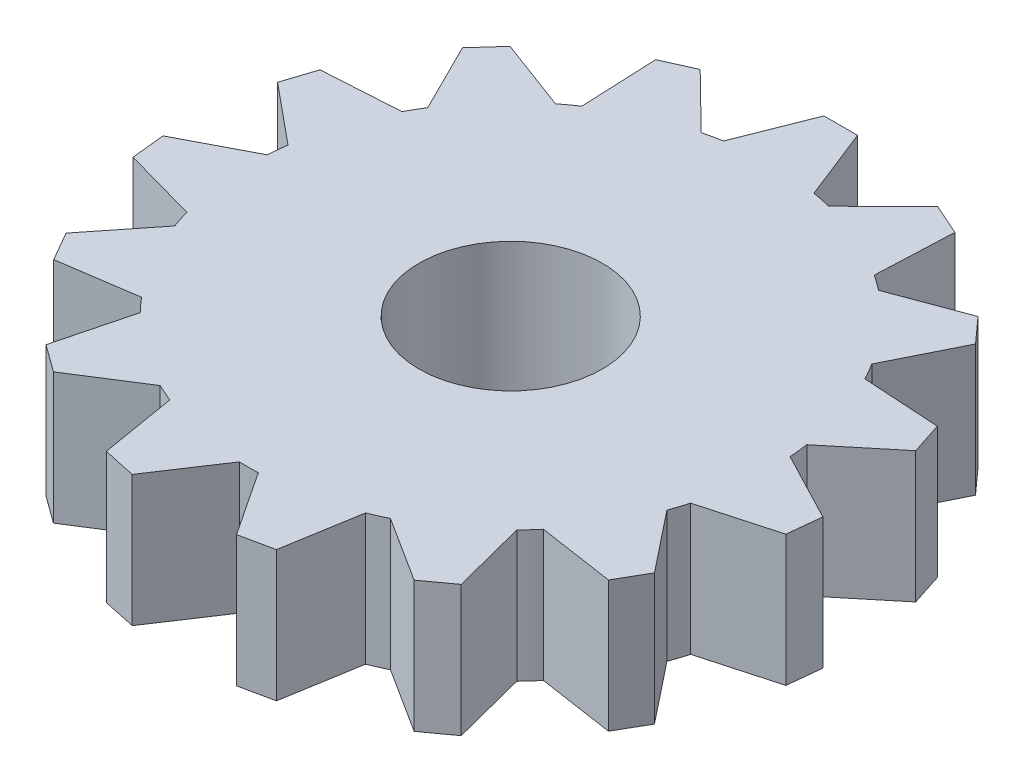
from build123d import *

# Parameters (mm, degrees)
CROQUIS1_R              = 5.25
SALIENTE_EXTRUIR1_DEPTH = 7.5


with BuildPart() as part:
    # Croquis1 → Saliente-Extruir1 (new body)
    with BuildSketch(Plane(origin=(0, 0, 0), x_dir=(1, 0, 0), z_dir=(0, 1, 0))):
        with BuildLine():
            Line((-2.5, 15), (-0.96403744, 18.894029408))
            Line((-0.96403744, 18.894029408), (0.96403744, 18.894029408))
            Line((0.96403744, 18.894029408), (2.5, 15))
            Line((2.5, 15), (2.588781311, 14.774918319))
            ThreePointArc((2.588781311, 14.774918319), (3.118675362, 14.672214011), (3.644531271, 14.550511737))
            Line((3.644531271, 14.550511737), (3.817186002, 14.720023472))
            Line((3.817186002, 14.720023472), (6.804202071, 17.652664095))
            Line((6.804202071, 17.652664095), (8.56558612, 16.86844539))
            Line((8.56558612, 16.86844539), (8.38491329, 12.686340257))
            Line((8.38491329, 12.686340257), (8.374470086, 12.444607297))
            ThreePointArc((8.374470086, 12.444607297), (8.816778784, 12.135254916), (9.247671287, 11.810189489))
            Line((9.247671287, 11.810189489), (9.474345866, 11.894821159))
            Line((9.474345866, 11.894821159), (13.39593323, 13.35899279))
            Line((13.39593323, 13.35899279), (14.686067144, 11.926153919))
            Line((14.686067144, 11.926153919), (12.819998898, 8.179097032))
            Line((12.819998898, 8.179097032), (12.712136904, 7.962510618))
            ThreePointArc((12.712136904, 7.962510618), (12.990381057, 7.5), (13.251804925, 7.027778186))
            Line((13.251804925, 7.027778186), (13.493305258, 7.012896206))
            Line((13.493305258, 7.012896206), (17.671385836, 6.755430269))
            Line((17.671385836, 6.755430269), (18.26719374, 4.92172209))
            Line((18.26719374, 4.92172209), (15.03839023, 2.257613625))
            Line((15.03839023, 2.257613625), (14.851759765, 2.103623516))
            ThreePointArc((14.851759765, 2.103623516), (14.917828431, 1.567926949), (14.964581102, 1.030200189))
            Line((14.964581102, 1.030200189), (15.179149589, 0.918377789))
            Line((15.179149589, 0.918377789), (18.891295291, -1.016207517))
            Line((18.891295291, -1.016207517), (18.689756586, -2.933720201))
            Line((18.689756586, -2.933720201), (14.656507272, -4.054231687))
            Line((14.656507272, -4.054231687), (14.423378438, -4.118999203))
            ThreePointArc((14.423378438, -4.118999203), (14.265847744, -4.635254916), (14.089845258, -5.145508779))
            Line((14.089845258, -5.145508779), (14.240381057, -5.334936491))
            Line((14.240381057, -5.334936491), (16.844728168, -8.612133791))
            Line((16.844728168, -8.612133791), (15.880690727, -10.281895618))
            Line((15.880690727, -10.281895618), (11.740381057, -9.665063509))
            Line((11.740381057, -9.665063509), (11.501063947, -9.629409539))
            ThreePointArc((11.501063947, -9.629409539), (11.147172382, -10.036959095), (10.778847167, -10.431512534))
            Line((10.778847167, -10.431512534), (10.83932127, -10.665791785))
            Line((10.83932127, -10.665791785), (11.885554515, -14.718943894))
            Line((11.885554515, -14.718943894), (10.32570917, -15.852237874))
            Line((10.32570917, -15.852237874), (6.794236298, -13.604718046))
            Line((6.794236298, -13.604718046), (6.590111016, -13.474807486))
            ThreePointArc((6.590111016, -13.474807486), (6.101049646, -13.703181865), (5.604088477, -13.913813005))
            Line((5.604088477, -13.913813005), (5.564044364, -14.152434784))
            Line((5.564044364, -14.152434784), (4.87126051, -18.28071488))
            Line((4.87126051, -18.28071488), (2.985318691, -18.681584188))
            Line((2.985318691, -18.681584188), (0.67330636, -15.191993238))
            Line((0.67330636, -15.191993238), (0.539668021, -14.990288804))
            ThreePointArc((0.539668021, -14.990288804), (0, -15), (-0.539668021, -14.990288804))
            Line((-0.539668021, -14.990288804), (-0.67330636, -15.191993238))
            Line((-0.67330636, -15.191993238), (-2.985318691, -18.681584188))
            Line((-2.985318691, -18.681584188), (-4.87126051, -18.28071488))
            Line((-4.87126051, -18.28071488), (-5.564044364, -14.152434784))
            Line((-5.564044364, -14.152434784), (-5.604088477, -13.913813005))
            ThreePointArc((-5.604088477, -13.913813005), (-6.101049646, -13.703181865), (-6.590111016, -13.474807486))
            Line((-6.590111016, -13.474807486), (-6.794236298, -13.604718046))
            Line((-6.794236298, -13.604718046), (-10.32570917, -15.852237874))
            Line((-10.32570917, -15.852237874), (-11.885554515, -14.718943894))
            Line((-11.885554515, -14.718943894), (-10.83932127, -10.665791785))
            Line((-10.83932127, -10.665791785), (-10.778847167, -10.431512534))
            ThreePointArc((-10.778847167, -10.431512534), (-11.147172382, -10.036959095), (-11.501063947, -9.629409539))
            Line((-11.501063947, -9.629409539), (-11.740381057, -9.665063509))
            Line((-11.740381057, -9.665063509), (-15.880690727, -10.281895618))
            Line((-15.880690727, -10.281895618), (-16.844728168, -8.612133791))
            Line((-16.844728168, -8.612133791), (-14.240381057, -5.334936491))
            Line((-14.240381057, -5.334936491), (-14.089845258, -5.145508779))
            ThreePointArc((-14.089845258, -5.145508779), (-14.265847744, -4.635254916), (-14.423378438, -4.118999203))
            Line((-14.423378438, -4.118999203), (-14.656507272, -4.054231687))
            Line((-14.656507272, -4.054231687), (-18.689756586, -2.933720201))
            Line((-18.689756586, -2.933720201), (-18.891295291, -1.016207517))
            Line((-18.891295291, -1.016207517), (-15.179149589, 0.918377789))
            Line((-15.179149589, 0.918377789), (-14.964581102, 1.030200189))
            ThreePointArc((-14.964581102, 1.030200189), (-14.917828431, 1.567926949), (-14.851759765, 2.103623516))
            Line((-14.851759765, 2.103623516), (-15.03839023, 2.257613625))
            Line((-15.03839023, 2.257613625), (-18.26719374, 4.92172209))
            Line((-18.26719374, 4.92172209), (-17.671385836, 6.755430269))
            Line((-17.671385836, 6.755430269), (-13.493305258, 7.012896206))
            Line((-13.493305258, 7.012896206), (-13.251804925, 7.027778186))
            ThreePointArc((-13.251804925, 7.027778186), (-12.990381057, 7.5), (-12.712136904, 7.962510618))
            Line((-12.712136904, 7.962510618), (-12.819998898, 8.179097032))
            Line((-12.819998898, 8.179097032), (-14.686067144, 11.926153919))
            Line((-14.686067144, 11.926153919), (-13.39593323, 13.35899279))
            Line((-13.39593323, 13.35899279), (-9.474345866, 11.894821159))
            Line((-9.474345866, 11.894821159), (-9.247671287, 11.810189489))
            ThreePointArc((-9.247671287, 11.810189489), (-8.816778784, 12.135254916), (-8.374470086, 12.444607297))
            Line((-8.374470086, 12.444607297), (-8.38491329, 12.686340257))
            Line((-8.38491329, 12.686340257), (-8.56558612, 16.86844539))
            Line((-8.56558612, 16.86844539), (-6.804202071, 17.652664095))
            Line((-6.804202071, 17.652664095), (-3.817186002, 14.720023472))
            Line((-3.817186002, 14.720023472), (-3.644531271, 14.550511737))
            ThreePointArc((-3.644531271, 14.550511737), (-3.118675362, 14.672214011), (-2.588781311, 14.774918319))
            Line((-2.588781311, 14.774918319), (-2.5, 15))
        make_face()
        with Locations(Location((0, 0, 0), (0, 0, 270))):
            Circle(CROQUIS1_R, mode=Mode.SUBTRACT)
    extrude(amount=SALIENTE_EXTRUIR1_DEPTH)


solid = part.part
